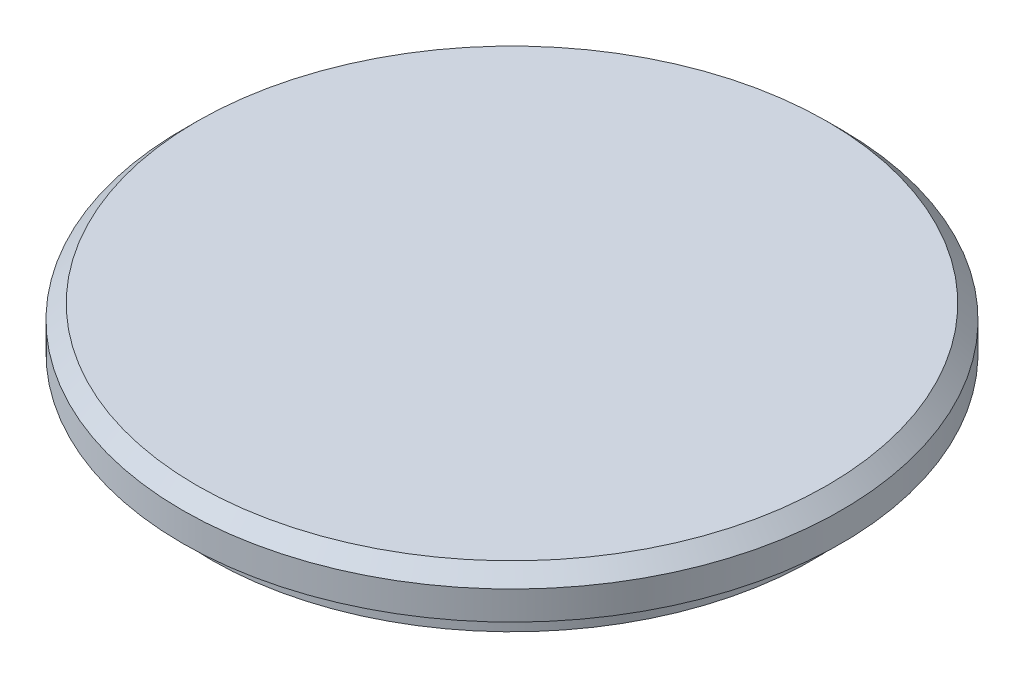
from build123d import *


with BuildPart() as part:
    # Esquisse1 → Base-Révolution (revolve)
    with BuildSketch(Plane.XY, mode=Mode.PRIVATE) as base_r_volution_sk:
        with BuildLine():
            Line((0, 12), (22, 12))
            Line((22, 12), (23, 11))
            Line((23, 11), (23, 9))
            Line((23, 9), (21, 9))
            Line((21, 9), (21, 7))
            Line((21, 7), (19, 7))
            Line((19, 7), (19, 9.5))
            ThreePointArc((19, 9.5), (18.853553391, 9.853553391), (18.5, 10))
            Line((18.5, 10), (0, 10))
            Line((0, 10), (0, 12))
        make_face()
    revolve(base_r_volution_sk.sketch.rotate(Axis((0, 60, 0), (0, -1, 0)), 90), axis=Axis((0, 60, 0), (0, -1, 0)))


solid = part.part
